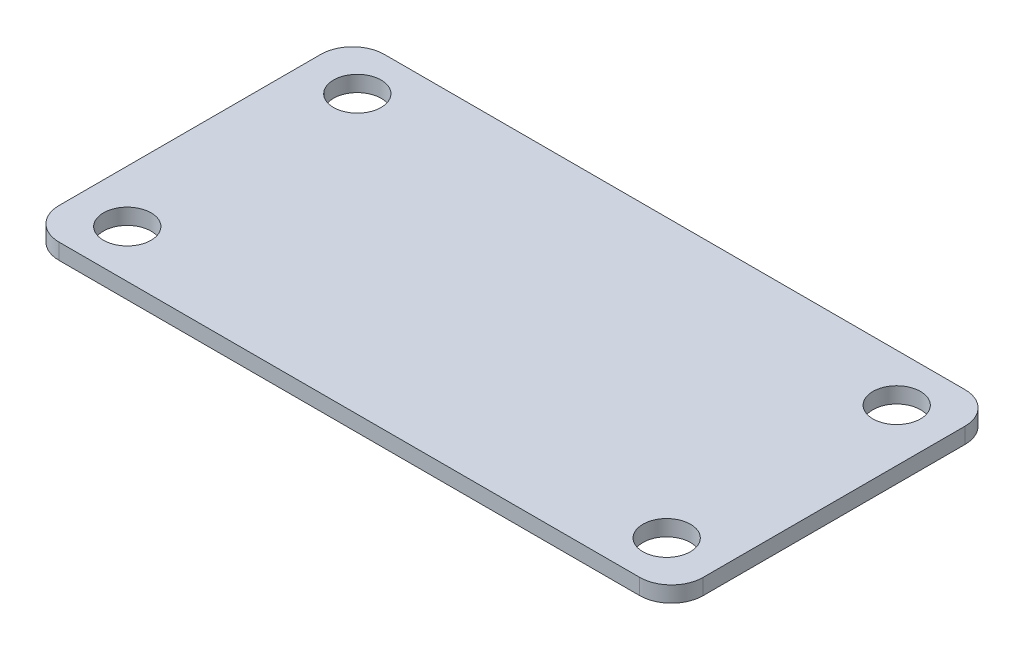
from build123d import *

# Parameters (mm, degrees)
SKETCH_1_W      = 40.6
SKETCH_1_H      = 20.5
SKETCH_1_R      = 1.5
EXTRUDE_1_DEPTH = 1
FILLET_1_R      = 2


with BuildPart() as part:
    # Эскиз1 → Бобышка-Вытянуть1 (new body)
    with BuildSketch(Plane(origin=(0, 0, 0), x_dir=(1, 0, 0), z_dir=(0, 1, 0))):
        Rectangle(SKETCH_1_W, SKETCH_1_H)
        with Locations(Location((-17, 7.25, 0), (0, 0, 270))):
            Circle(SKETCH_1_R, mode=Mode.SUBTRACT)
        with Locations(Location((-17, -7.25, 0), (0, 0, 270))):
            Circle(SKETCH_1_R, mode=Mode.SUBTRACT)
        with Locations(Location((17, -7.25, 0), (0, 0, 270))):
            Circle(SKETCH_1_R, mode=Mode.SUBTRACT)
        with Locations(Location((17, 7.25, 0), (0, 0, 270))):
            Circle(SKETCH_1_R, mode=Mode.SUBTRACT)
    extrude(amount=EXTRUDE_1_DEPTH)

    # Скругление1
    fillet_1_edges = [part.edges().sort_by_distance(p)[0] for p in [
        (-20.3, 0.5, -10.25),
        (20.3, 0.5, -10.25),
        (20.3, 0.5, 10.25),
        (-20.3, 0.5, 10.25),
    ]]
    fillet(fillet_1_edges, radius=FILLET_1_R)


solid = part.part
